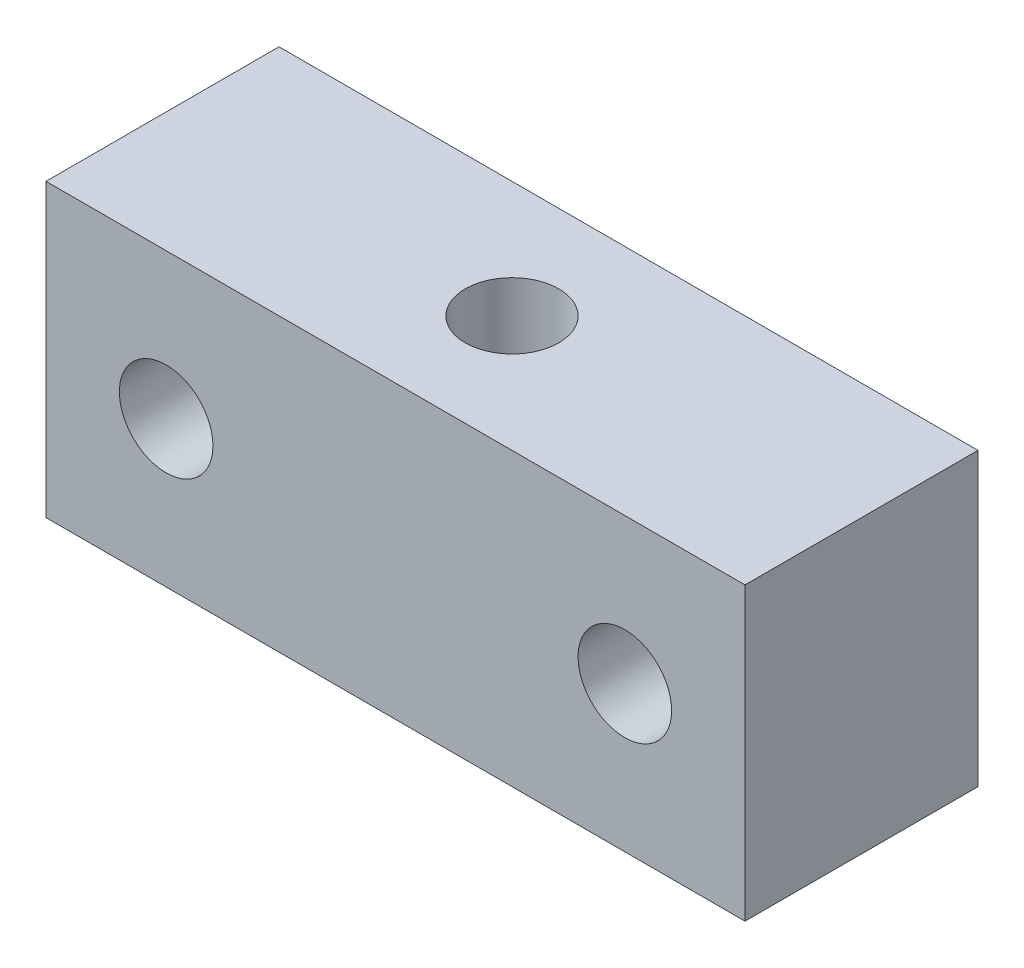
from build123d import *

# Parameters (mm, degrees)
SKETCH1_W           = 76.2
SKETCH1_H           = 31.75
BOSS_EXTRUDE1_DEPTH = 25.4
M12_TAPPED_HOLE2_D  = 10.2
M12_TAPPED_HOLE1_D  = 10.2


with BuildPart() as part:
    # Sketch1 → Boss-Extrude1 (new body)
    with BuildSketch(Plane.XY):
        with Locations((38.1, 15.875)):
            Rectangle(SKETCH1_W, SKETCH1_H)
    extrude(amount=BOSS_EXTRUDE1_DEPTH)

    # M12 Tapped Hole2 (through all)
    with Locations(Plane.XY.offset(25.4)):
        with Locations((13.1, 15.875), (63.1, 15.875)):
            Hole(M12_TAPPED_HOLE2_D / 2)

    # M12 Tapped Hole1 (through all)
    with Locations(Plane(origin=(0, 31.75, 0), x_dir=(1, 0, 0), z_dir=(0, 1, 0))):
        with Locations((38.1, -12.7)):
            Hole(M12_TAPPED_HOLE1_D / 2)


solid = part.part
